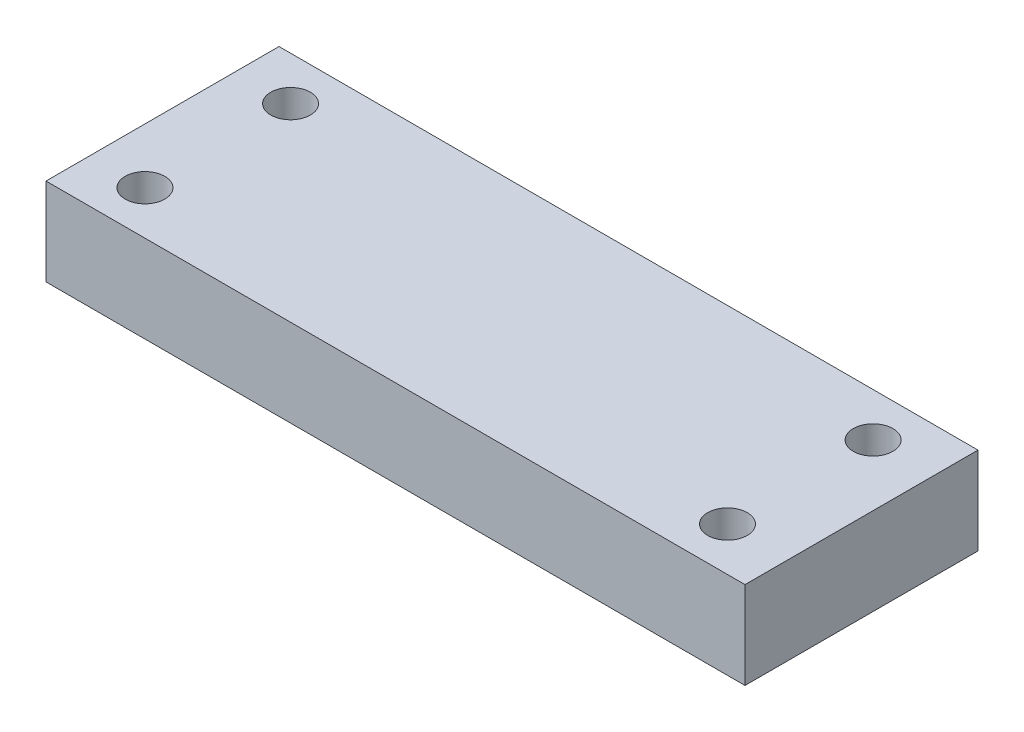
from build123d import *

# Parameters (mm, degrees)
SKETCH1_W           = 76.2
SKETCH1_H           = 25.4
BOSS_EXTRUDE1_DEPTH = 9.525
SKETCH2_R           = 2.159
CUT_EXTRUDE1_DEPTH  = 42.275


with BuildPart() as part:
    # Sketch1 → Boss-Extrude1 (new body)
    with BuildSketch(Plane(origin=(0, 0, 0), x_dir=(1, 0, 0), z_dir=(0, 1, 0))):
        Rectangle(SKETCH1_W, SKETCH1_H)
    extrude(amount=BOSS_EXTRUDE1_DEPTH)

    # Sketch2 → Cut-Extrude1 (cut, through all)
    with BuildSketch(Plane(origin=(0, 9.525, 0), x_dir=(1, 0, 0), z_dir=(0, 1, 0))):
        with Locations(Location((-32.074075882, 7.9375, 0), (0, 0, 270))):
            Circle(SKETCH2_R)
        with Locations(Location((-32.074075882, -7.9375, 0), (0, 0, 270))):
            Circle(SKETCH2_R)
        with Locations(Location((31.425924118, 7.9375, 0), (0, 0, 270))):
            Circle(SKETCH2_R)
        with Locations(Location((31.425924118, -7.9375, 0), (0, 0, 270))):
            Circle(SKETCH2_R)
    extrude(amount=-CUT_EXTRUDE1_DEPTH, mode=Mode.SUBTRACT)


solid = part.part
